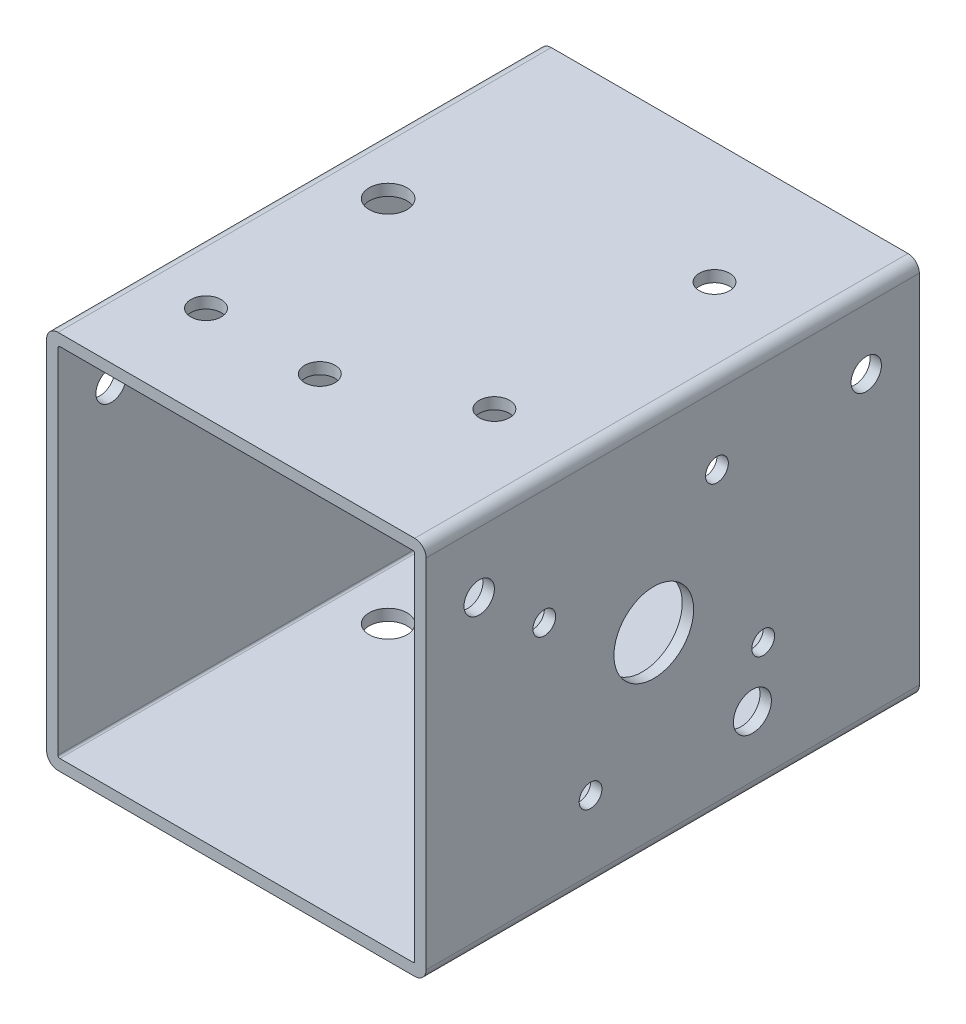
from build123d import *

# Parameters (mm, degrees)
SKETCH1_W                      = 100
SKETCH1_H                      = 100
SKETCH1_W_2                    = 94
SKETCH1_H_2                    = 94
EXTRUDE_THIN1_DEPTH            = 130
FILLET1_R                      = 0.5
FILLET2_R                      = 3
F_8_0_8_DIAMETER_HOLE2_D       = 8
F_8_0_8_DIAMETER_HOLE3_D       = 8
F_10_0_10_DIAMETER_HOLE1_D     = 10
F_10_0_10_DIAMETER_HOLE2_D     = 10
F_6_0_6_DIAMETER_HOLE2_D       = 6
F_6_0_6_DIAMETER_HOLE2_DEPTH   = 3
F_6_0_6_DIAMETER_HOLE3_D       = 6
F_6_0_6_DIAMETER_HOLE3_DEPTH   = 3
F_21_0_21_DIAMETER_HOLE1_D     = 21
F_21_0_21_DIAMETER_HOLE1_DEPTH = 3
F_6_0_6_DIAMETER_HOLE1_D       = 6
F_6_0_6_DIAMETER_HOLE1_DEPTH   = 3
F_8_0_8_DIAMETER_HOLE4_D       = 8
F_8_0_8_DIAMETER_HOLE4_DEPTH   = 3
SKETCH33_R                     = 4
CUT_EXTRUDE1_DEPTH             = 10


with BuildPart() as part:
    # Sketch1 → Extrude-Thin1 (new body)
    with BuildSketch(Plane.XY):
        Rectangle(SKETCH1_W, SKETCH1_H)
        Rectangle(SKETCH1_W_2, SKETCH1_H_2, mode=Mode.SUBTRACT)
    extrude(amount=EXTRUDE_THIN1_DEPTH)

    # Fillet1
    fillet1_edges = [part.edges().sort_by_distance(p)[0] for p in [
        (47, -47, 65),
        (47, 47, 65),
        (-47, 47, 65),
        (-47, -47, 65),
    ]]
    fillet(fillet1_edges, radius=FILLET1_R)

    # Fillet2
    fillet2_edges = [part.edges().sort_by_distance(p)[0] for p in [
        (50, -50, 65),
        (-50, -50, 65),
        (-50, 50, 65),
        (50, 50, 65),
    ]]
    fillet(fillet2_edges, radius=FILLET2_R)

    # Ø8.0 (8) Diameter Hole2 (through all)
    with Locations(Plane(origin=(0, 50, 0), x_dir=(1, 0, 0), z_dir=(0, 1, 0))):
        with Locations((28, -32), (28, -90)):
            Hole(F_8_0_8_DIAMETER_HOLE2_D / 2)

    # Ø8.0 (8) Diameter Hole3 (through all)
    with Locations(Plane(origin=(50, 0, 0), x_dir=(0, 0, -1), z_dir=(1, 0, 0))):
        with Locations((-14, 31), (-116, 31)):
            Hole(F_8_0_8_DIAMETER_HOLE3_D / 2)

    # Ø10.0 (10) Diameter Hole1 (through all)
    with Locations(Plane(origin=(0, 50, 0), x_dir=(1, 0, 0), z_dir=(0, 1, 0))):
        with Locations((-34, -56)):
            Hole(F_10_0_10_DIAMETER_HOLE1_D / 2)

    # Ø10.0 (10) Diameter Hole2 (through all)
    with Locations(Plane(origin=(50, 0, 0), x_dir=(0, 0, -1), z_dir=(1, 0, 0))):
        with Locations((-44, -31)):
            Hole(F_10_0_10_DIAMETER_HOLE2_D / 2)

    # Ø6.0 (6) Diameter Hole2
    with Locations(Plane.ZY.offset(50)):
        with Locations((56, -15), (56, 35)):
            Hole(F_6_0_6_DIAMETER_HOLE2_D / 2, depth=F_6_0_6_DIAMETER_HOLE2_DEPTH)

    # Ø6.0 (6) Diameter Hole3
    with Locations(Plane(origin=(0, -50, 0), x_dir=(-1, 0, 0), z_dir=(0, -1, 0))):
        with Locations((20, -44), (-35, -44)):
            Hole(F_6_0_6_DIAMETER_HOLE3_D / 2, depth=F_6_0_6_DIAMETER_HOLE3_DEPTH)

    # Ø21.0 (21) Diameter Hole1
    with Locations(Plane(origin=(50, 0, 0), x_dir=(0, 0, -1), z_dir=(1, 0, 0))):
        with Locations((-70, 0)):
            Hole(F_21_0_21_DIAMETER_HOLE1_D / 2, depth=F_21_0_21_DIAMETER_HOLE1_DEPTH)

    # Ø6.0 (6) Diameter Hole1
    with Locations(Plane(origin=(50, 0, 0), x_dir=(0, 0, -1), z_dir=(1, 0, 0))):
        with Locations((-41.157258279, -16.652364697), (-53.347635303, 28.842741721), (-98.842741721, 16.652364697), (-86.652364697, -28.842741721)):
            Hole(F_6_0_6_DIAMETER_HOLE1_D / 2, depth=F_6_0_6_DIAMETER_HOLE1_DEPTH)

    # Ø8.0 (8) Diameter Hole4
    with Locations(Plane(origin=(0, 50, 0), x_dir=(1, 0, 0), z_dir=(0, 1, 0))):
        with Locations((-3, -105)):
            Hole(F_8_0_8_DIAMETER_HOLE4_D / 2, depth=F_8_0_8_DIAMETER_HOLE4_DEPTH)

    # Sketch33 → Cut-Extrude1 (cut)
    with BuildSketch(Plane(origin=(0, 50, 0), x_dir=(1, 0, 0), z_dir=(0, 1, 0))):
        with Locations(Location((-33, -105, 0), (0, 0, 270))):
            Circle(SKETCH33_R)
    extrude(amount=-CUT_EXTRUDE1_DEPTH, mode=Mode.SUBTRACT)


solid = part.part
